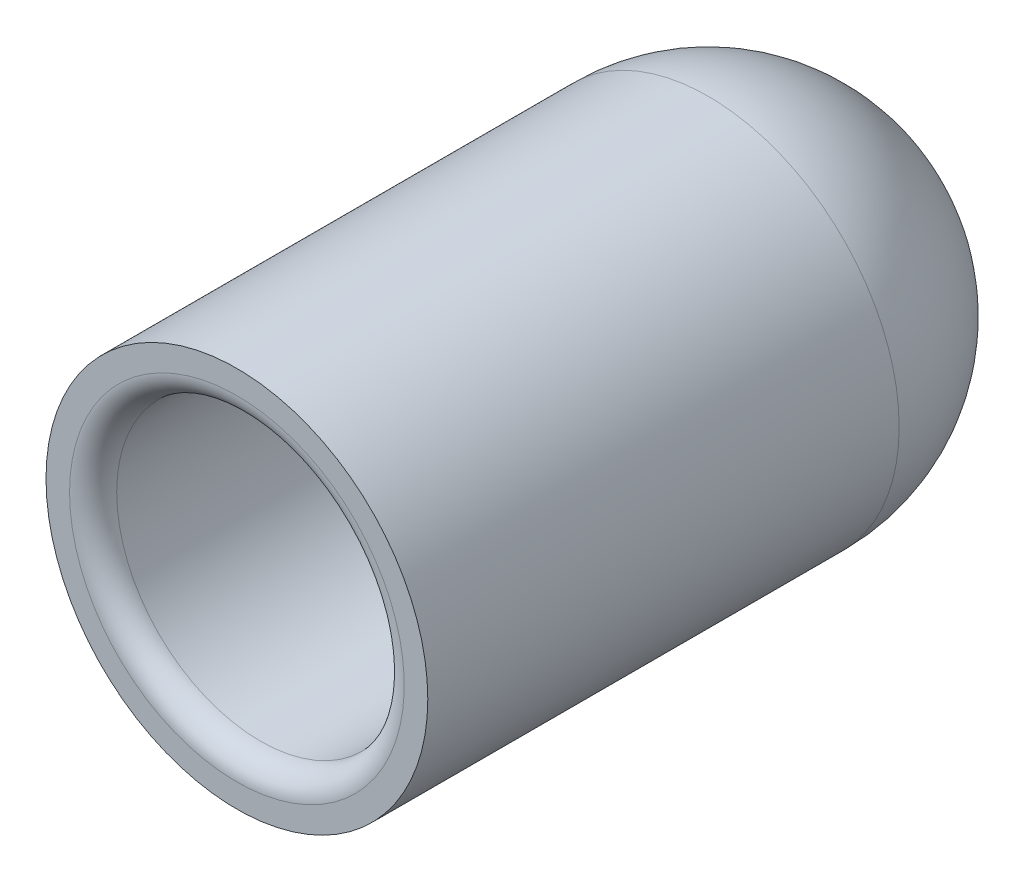
from build123d import *

# Parameters (mm, degrees)
FILLET1_R = 1


with BuildPart() as part:
    # Sketch1 → Revolve1 (revolve)
    with BuildSketch(Plane(origin=(0, 0, 0), x_dir=(1, 0, 0), z_dir=(0, 1, 0))):
        with BuildLine():
            Line((-8.1, 0), (-6.1, 0))
            Line((-6.1, 0), (-6.1, 20))
            ThreePointArc((-6.1, 20), (-4.313351365, 24.313351365), (0, 26.1))
            Line((0, 26.1), (0, 28.1))
            ThreePointArc((0, 28.1), (-5.727564928, 25.727564928), (-8.1, 20))
            Line((-8.1, 20), (-8.1, 0))
        make_face()
    revolve(axis=Axis((0, 0, 0), (0, 0, -1)))

    # Fillet1
    fillet1_edges = [part.edges().sort_by_distance(p)[0] for p in [
        (6.1, 0, 0),
    ]]
    fillet(fillet1_edges, radius=FILLET1_R)


solid = part.part
